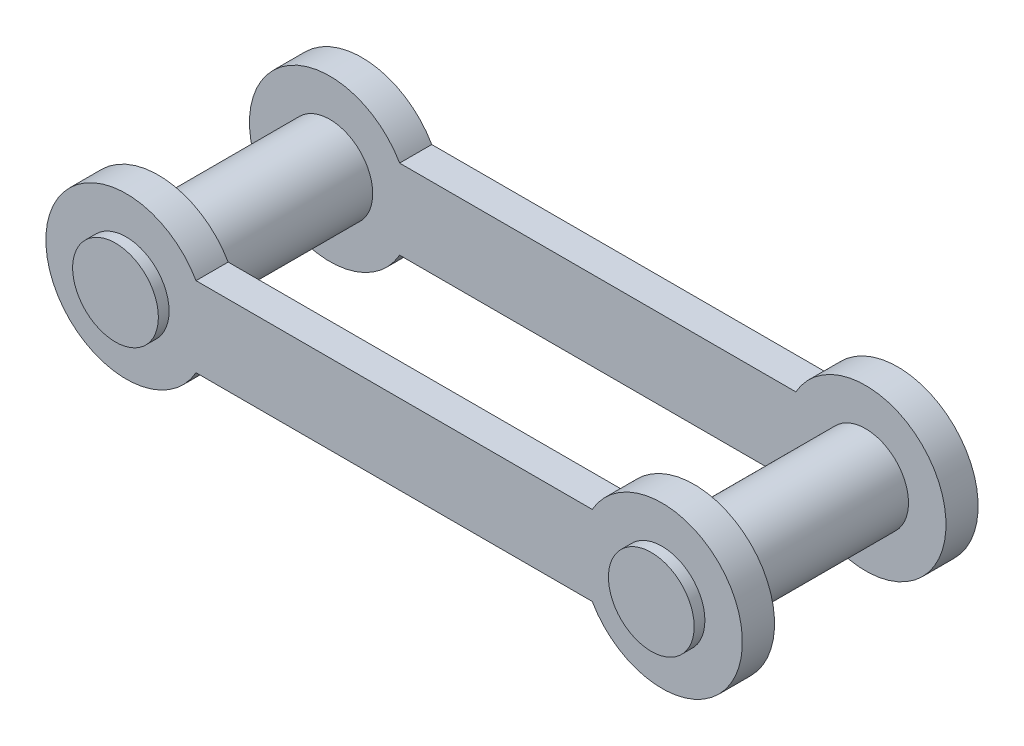
from build123d import *

# Parameters (mm, degrees)
SKETCH_1_R           = 4
EXTRUDE_1_DEPTH      = 3
EXTRUDE_2_DEPTH      = 20
EXTRUDE_2_DEPTH_BACK = 4
SKETCH_2_R           = 4


with BuildPart() as part:
    # 草图1 → 凸台-拉伸1 (new body)
    with BuildSketch(Plane.XY):
        with BuildLine():
            Line((-6.52657961, 5.455372618), (30.448093928, 5.455372618))
            ThreePointArc((30.448093928, 5.455372618), (44.460757159, 1.735800378), (30.448093928, -1.983771861))
            Line((30.448093928, -1.983771861), (-6.52657961, -1.983771861))
            ThreePointArc((-6.52657961, -1.983771861), (-20.539242841, 1.735800378), (-6.52657961, 5.455372618))
        make_face()
        with Locations((-13.039242841, 1.735800378)):
            Circle(SKETCH_1_R, mode=Mode.SUBTRACT)
        with Locations(Location((36.960757159, 1.735800378, 0), (0, 0, 180))):
            Circle(SKETCH_1_R, mode=Mode.SUBTRACT)
    extrude_1 = extrude(amount=EXTRUDE_1_DEPTH)

    # 草图2 → 凸台-拉伸2 (add, two sides: drawn at the far end of the back side and taken through both)
    with BuildSketch(Plane.XY.offset(3).offset(-EXTRUDE_2_DEPTH_BACK)):
        with Locations((-13.039242841, 1.735800378)):
            Circle(SKETCH_2_R)
        with Locations((36.960757159, 1.735800378)):
            Circle(SKETCH_2_R)
    extrude(amount=EXTRUDE_2_DEPTH + EXTRUDE_2_DEPTH_BACK)

    # 镜向1: 凸台-拉伸1 across plane
    add(extrude_1.mirror(Plane(origin=(0, 0, 11), x_dir=(1, 0, 0), z_dir=(0, 0, -1))))


solid = part.part
